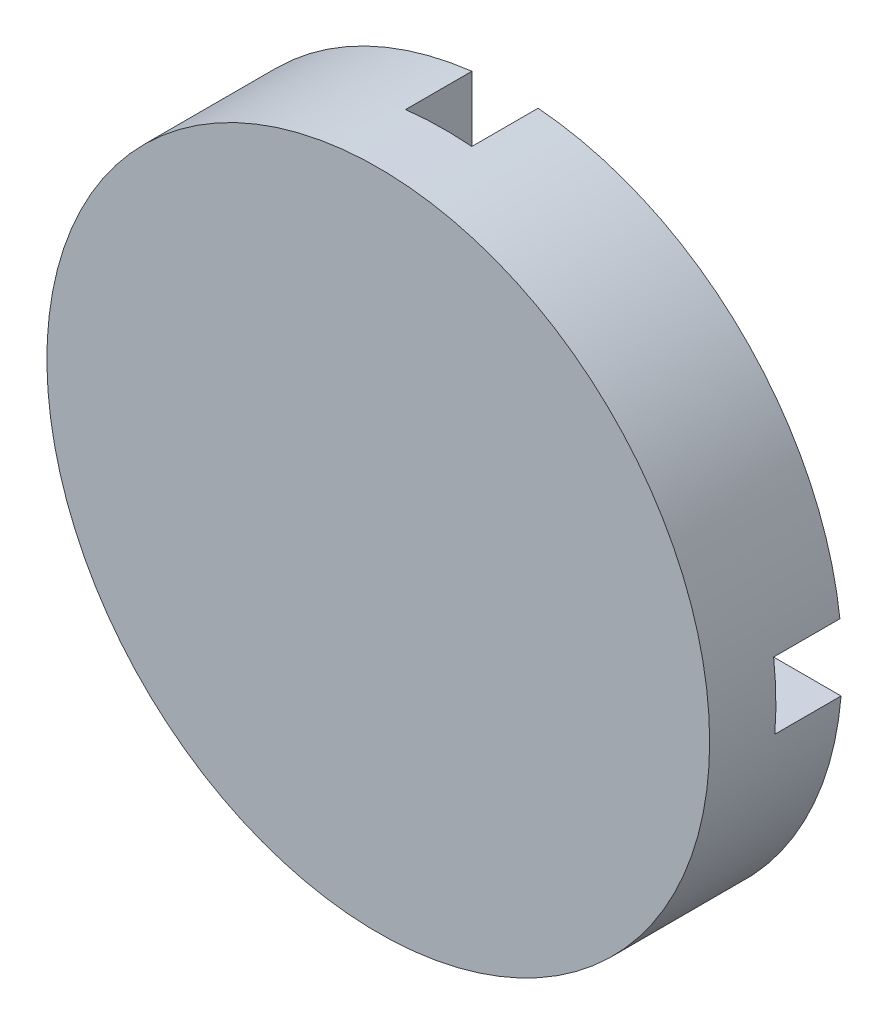
from build123d import *
from build123d.topology import SkipClean

# Parameters (mm, degrees)
BOSS_EXTRUDE1_DEPTH   = 10
BOSS_EXTRUDE1_2_DEPTH = 10
BOSS_EXTRUDE1_3_DEPTH = 10
BOSS_EXTRUDE1_4_DEPTH = 10
SKETCH3_R             = 50
BOSS_EXTRUDE2_DEPTH   = 10


with BuildPart() as part:
    # Sketch2 → Boss-Extrude1 (new body)
    with BuildSketch(Plane.XY):
        with BuildLine():
            Line((4.12040185, 49.82993366), (4.12040185, 5.879436141))
            Line((4.12040185, 5.879436141), (49.653119043, 5.879436141))
            ThreePointArc((49.653119043, 5.879436141), (34.724767031, 35.974860036), (4.12040185, 49.82993366))
        make_face()
    extrude(amount=BOSS_EXTRUDE1_DEPTH)



with BuildPart() as body_2:
    # Sketch2 → Boss-Extrude1 2 (new body)
    with BuildSketch(Plane.XY):
        with BuildLine():
            Line((-5.87959815, 49.653099859), (-5.87959815, 5.879436141))
            Line((-5.87959815, 5.879436141), (-49.653119043, 5.879436141))
            ThreePointArc((-49.653119043, 5.879436141), (-35.355396738, 35.35528138), (-5.87959815, 49.653099859))
        make_face()
    extrude(amount=BOSS_EXTRUDE1_2_DEPTH)


with BuildPart() as body_3:
    # Sketch2 → Boss-Extrude1 3 (new body)
    with BuildSketch(Plane.XY):
        with BuildLine():
            Line((-49.829920264, -4.120563859), (-5.87959815, -4.120563859))
            Line((-5.87959815, -4.120563859), (-5.87959815, -49.653099859))
            ThreePointArc((-5.87959815, -49.653099859), (-35.974860237, -34.724766823), (-49.829920264, -4.120563859))
        make_face()
    extrude(amount=BOSS_EXTRUDE1_3_DEPTH)


with BuildPart() as body_4:
    # Sketch2 → Boss-Extrude1 4 (new body)
    with BuildSketch(Plane.XY):
        with BuildLine():
            Line((4.12040185, -4.120563859), (4.12040185, -49.82993366))
            ThreePointArc((4.12040185, -49.82993366), (35.355281585, -35.355396534), (49.829920264, -4.120563859))
            Line((49.829920264, -4.120563859), (4.12040185, -4.120563859))
        make_face()
    extrude(amount=BOSS_EXTRUDE1_4_DEPTH)


with BuildPart() as part_1:
    with SkipClean():  # the faces are left unmerged after this step: merging them gives an invalid solid
        add(part.part)

        add(body_2.part)  # Boss-Extrude2 merges body 2

        add(body_3.part)  # Boss-Extrude2 merges body 3

        add(body_4.part)  # Boss-Extrude2 merges body 4
        # Sketch3 → Boss-Extrude2 (add)
        with BuildSketch(Plane.XY.offset(10)):
            with Locations(Location((0, 0, 0), (0, 0, 184.727179566))):
                Circle(SKETCH3_R)
        extrude(amount=BOSS_EXTRUDE2_DEPTH)


solid = part_1.part
